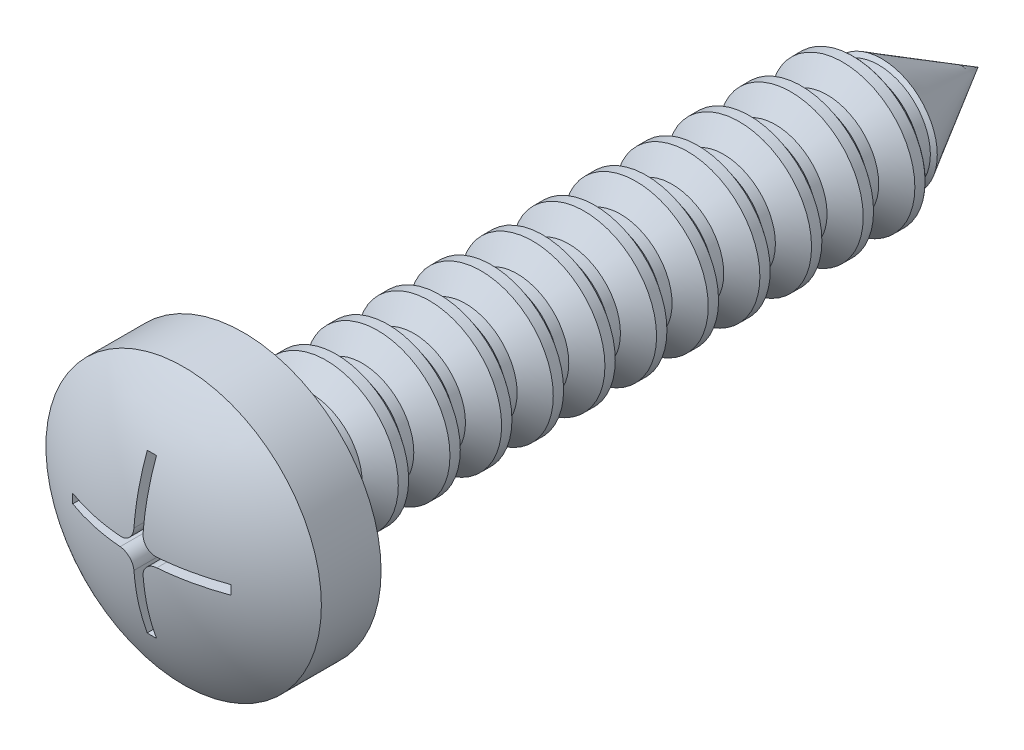
from build123d import *

# Parameters (mm, degrees)
CUT_EXTRUDE_2_DEPTH    = 3.6
PATTERN_LINEAR_1_COUNT = 13
PATTERN_LINEAR_1_PITCH = 2.25
FILLET_1_R             = 0.25


with BuildPart() as part:
    # 草图8 → Revolve 1408 (revolve)
    with BuildSketch(Plane(origin=(0, 0, 0), x_dir=(0, 0, -1), z_dir=(1, 0, 0)), mode=Mode.PRIVATE) as revolve_1408_sk:
        with BuildLine():
            Line((0, 0), (-36.6, 0))
            ThreePointArc((-36.6, 0), (-36.086832981, 3.16227766), (-34.6, 6))
            Line((-34.6, 6), (-32, 6))
            Line((-32, 6), (-32, 3.15))
            Line((-32, 3.15), (-5.455960044, 3.15))
            Line((-5.455960044, 3.15), (0, 0))
        make_face()
    revolve(revolve_1408_sk.sketch.rotate(Axis((0, 0, 11.71), (0, 0, -1)), 90), axis=Axis((0, 0, 11.71), (0, 0, -1)))

    # 草图7 → 切除-拉伸2 (cut)
    with BuildSketch(Plane.XY.offset(36.6)):
        with BuildLine():
            Line((0.2, 3.44419802), (0.2, 0.797500009))
            ThreePointArc((0.2, 0.797500009), (0.375003701, 0.375003701), (0.797500009, 0.2))
            Line((0.797500009, 0.2), (3.44419802, 0.2))
            ThreePointArc((3.44419802, 0.2), (3.45, 0), (3.44419802, -0.2))
            Line((3.44419802, -0.2), (0.797500009, -0.2))
            ThreePointArc((0.797500009, -0.2), (0.375003701, -0.375003701), (0.2, -0.797500009))
            Line((0.2, -0.797500009), (0.2, -3.44419802))
            ThreePointArc((0.2, -3.44419802), (0, -3.45), (-0.2, -3.44419802))
            Line((-0.2, -3.44419802), (-0.2, -0.797500009))
            ThreePointArc((-0.2, -0.797500009), (-0.375003701, -0.375003701), (-0.797500009, -0.2))
            Line((-0.797500009, -0.2), (-3.44419802, -0.2))
            ThreePointArc((-3.44419802, -0.2), (-3.45, 0), (-3.44419802, 0.2))
            Line((-3.44419802, 0.2), (-0.797500009, 0.2))
            ThreePointArc((-0.797500009, 0.2), (-0.375003701, 0.375003701), (-0.2, 0.797500009))
            Line((-0.2, 0.797500009), (-0.2, 3.44419802))
            ThreePointArc((-0.2, 3.44419802), (0, 3.45), (0.2, 3.44419802))
        make_face()
    extrude(amount=-CUT_EXTRUDE_2_DEPTH, mode=Mode.SUBTRACT)

    # 草图9 → 切除-旋转1 (revolve, cut)
    with BuildSketch(Plane(origin=(0, 0, 0), x_dir=(0, 0, -1), z_dir=(1, 0, 0)), mode=Mode.PRIVATE) as cut_revolve_1_sk:
        Polygon((-30.2, 3.15), (-28.4, 3.15), (-29.075, 2.25), (-29.525, 2.25), align=None)
    cut_revolve_1 = revolve(cut_revolve_1_sk.sketch.rotate(Axis((0, 0, 6.911978604), (0, 0, -1)), 90), axis=Axis((0, 0, 6.911978604), (0, 0, -1)), mode=Mode.SUBTRACT)

    # 阵列(线性)1: 切除-旋转1 ×13
    with Locations(*[(0, 0, -i * PATTERN_LINEAR_1_PITCH) for i in range(1, PATTERN_LINEAR_1_COUNT)]):
        add(cut_revolve_1, mode=Mode.SUBTRACT)

    # 圆角1
    fillet_1_edges = [part.edges().sort_by_distance(p)[0] for p in [
        (-3.15, 0, 32),
    ]]
    fillet(fillet_1_edges, radius=FILLET_1_R)


solid = part.part
